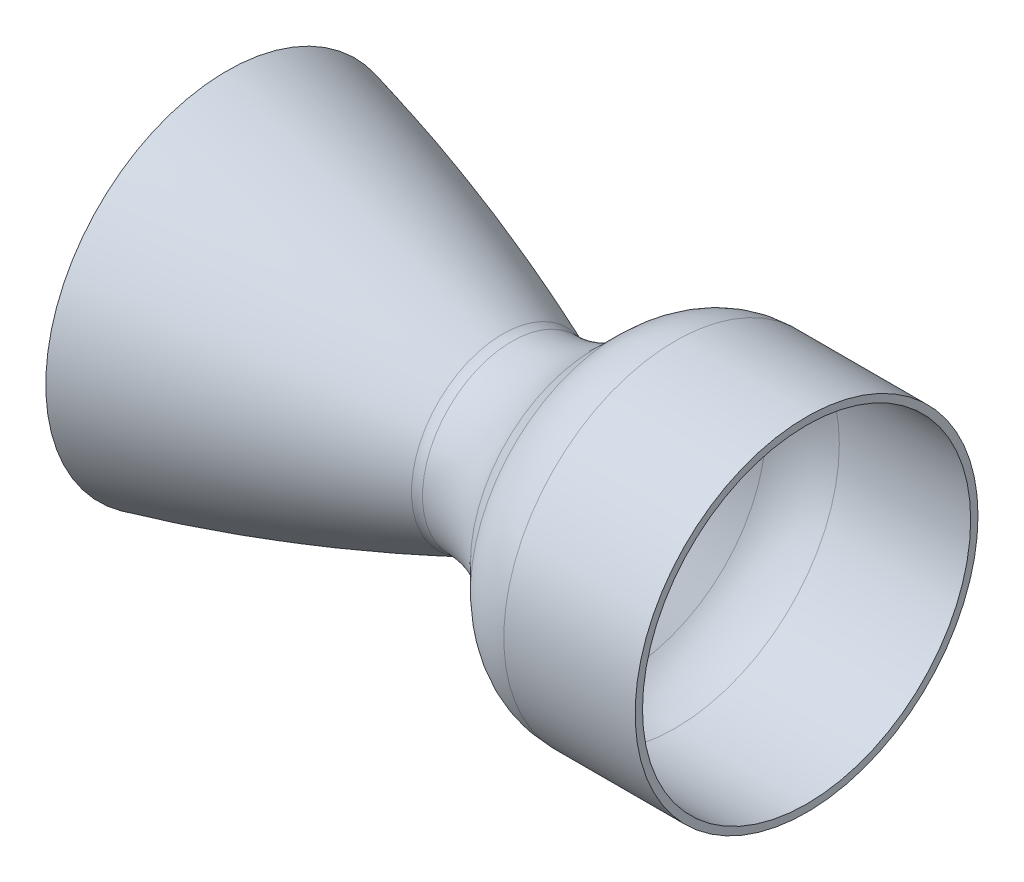
from build123d import *


with BuildPart() as part:
    # Sketch1 → Revolve1 (revolve)
    with BuildSketch(Plane.XY, mode=Mode.PRIVATE) as revolve1_sk:
        with BuildLine():
            Line((41.860840685, 22.4), (23.931908497, 22.4))
            ThreePointArc((23.931908497, 22.4), (20.105074173, 21.638795325), (16.860840685, 19.471067812))
            Line((16.860840685, 19.471067812), (13.510378949, 16.120606076))
            ThreePointArc((13.510378949, 16.120606076), (8.060066689, 12.478823854), (1.630985025, 11.2))
            ThreePointArc((1.630985025, 11.2), (0.799647289, 11.281545925), (0, 11.523075183))
            add(Edge.make_bspline(
                [(0, 11.523075183), (-18.863821879, 19.301604743), (-37.496027464, 23.758787848)],
                knots=[0, 0, 0, 1, 1, 1], degree=2))
            Line((-37.496027464, 23.758787848), (-37.263372503, 24.731347188))
            add(Edge.make_bspline(
                [(0.381213777, 12.447562098), (-18.550314145, 20.254410518), (-37.263372503, 24.731347188)],
                knots=[0, 0, 0, 1, 1, 1], degree=2))
            ThreePointArc((0.381213777, 12.447562098), (0.993957717, 12.262486013), (1.630985025, 12.2))
            ThreePointArc((1.630985025, 12.2), (7.677383257, 13.402703386), (12.803272168, 16.827712857))
            Line((12.803272168, 16.827712857), (16.153733904, 20.178174593))
            ThreePointArc((16.153733904, 20.178174593), (19.722390741, 22.562674858), (23.931908497, 23.4))
            Line((23.931908497, 23.4), (41.860840685, 23.4))
            Line((41.860840685, 23.4), (41.860840685, 22.4))
        make_face()
    revolve(revolve1_sk.sketch.rotate(Axis((0, 0, 0), (-1, 0, 0)), 90), axis=Axis((0, 0, 0), (-1, 0, 0)))


solid = part.part
